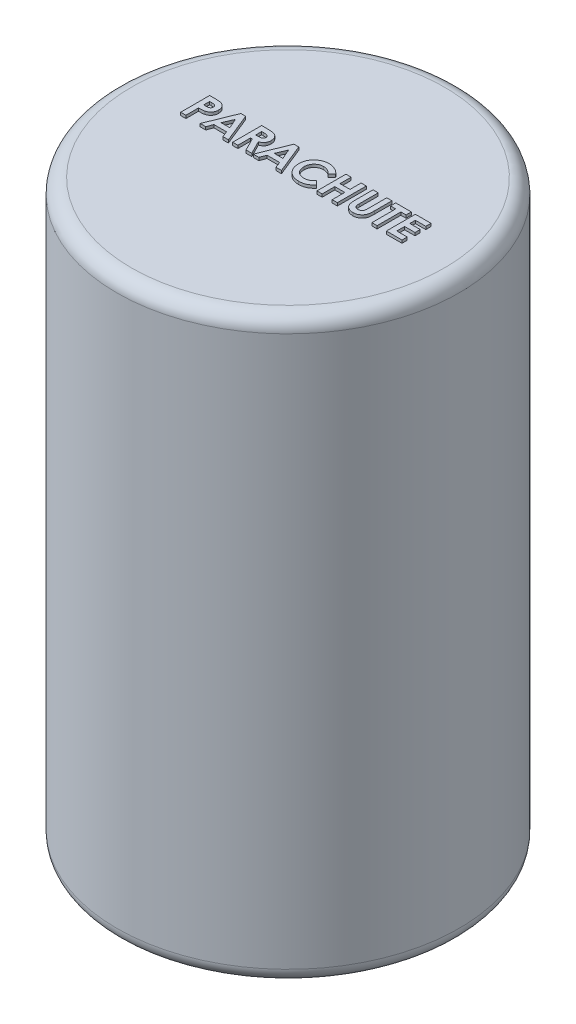
from build123d import *

# Parameters (mm, degrees)
SKETCH1_R           = 75
BOSS_EXTRUDE1_DEPTH = 254
FILLET1_R           = 6.35
BOSS_EXTRUDE2_DEPTH = 1.27
CUT_EXTRUDE1_DEPTH  = 0.635


with BuildPart() as part:
    # Sketch1 → Boss-Extrude1 (new body)
    with BuildSketch(Plane(origin=(0, 0, 0), x_dir=(1, 0, 0), z_dir=(0, 1, 0))):
        with Locations(Location((0, 0, 0), (0, 0, 270))):
            Circle(SKETCH1_R)
    extrude(amount=BOSS_EXTRUDE1_DEPTH)

    # Fillet1
    fillet1_edges = [part.edges().sort_by_distance(p)[0] for p in [
        (0, 0, -75),
        (0, 254, -75),
    ]]
    fillet(fillet1_edges, radius=FILLET1_R)

    # Sketch2 → Boss-Extrude2 (add)
    # profile 1 of 9: a face of its own
    with BuildSketch(Plane(origin=(0, 254, 0), x_dir=(1, 0, 0), z_dir=(0, 1, 0))):
        Polygon((43.147435897, 12.7), (49.985897436, 12.7), (49.985897436, 10.420512821), (45.426923077, 10.420512821), (45.426923077, 7.978205128), (49.985897436, 7.978205128), (49.985897436, 5.698717949), (45.426923077, 5.698717949), (45.426923077, 2.279487179), (49.985897436, 2.279487179), (49.985897436, 0), (43.147435897, 0), align=None)
    # profile 2 of 9: a face of its own
    with BuildSketch(Plane(origin=(0, 254, 0), x_dir=(1, 0, 0), z_dir=(0, 1, 0))):
        Polygon((34.517948718, 12.7), (41.356410256, 12.7), (41.356410256, 10.420512821), (39.076923077, 10.420512821), (39.076923077, 0), (36.797435897, 0), (36.797435897, 10.420512821), (34.517948718, 10.420512821), align=None)
    # profile 3 of 9: a face of its own
    with BuildSketch(Plane(origin=(0, 254, 0), x_dir=(1, 0, 0), z_dir=(0, 1, 0))):
        with BuildLine():
            Line((24.585897436, 12.7), (26.865384615, 12.7))
            Line((26.865384615, 12.7), (26.865384615, 4.436858974))
            add(Edge.make_bspline(
                [(26.865384615, 4.436858974), (26.865508563, 4.351190312), (26.865747966, 4.185722176), (26.877732598, 3.948329576), (26.888699363, 3.730116072), (26.908486521, 3.531320561), (26.937718934, 3.351858005), (26.966025449, 3.190575601), (27.004335517, 3.050360927), (27.061909426, 2.89075992), (27.150611919, 2.711439471), (27.295546871, 2.524547585), (27.462789406, 2.353981612), (27.663239218, 2.21200896), (27.888527079, 2.09716588), (28.137415133, 2.012079867), (28.409552536, 1.964783342), (28.597720623, 1.957562661), (28.694571314, 1.953846154)],
                knots=[0, 0, 0, 0, 1.155499968, 2.231836252, 3.205919964, 4.102923608, 4.924856345, 5.658536265, 6.31071849, 6.882491295, 7.94666036, 8.992281882, 10.060072772, 11.158554251, 12.289267114, 13.461410017, 14.693379945, 16, 16, 16, 16], degree=3))
            add(Edge.make_bspline(
                [(28.694571314, 1.953846154), (28.797463222, 1.956848614), (28.998085022, 1.962702903), (29.286647543, 2.02016909), (29.554002356, 2.111674939), (29.794488646, 2.242277107), (30.007867092, 2.398826694), (30.188487475, 2.577342281), (30.331032418, 2.778179918), (30.423937909, 2.963467931), (30.476099766, 3.134009413), (30.515197677, 3.286381755), (30.543860771, 3.466166036), (30.569864872, 3.670554536), (30.585491333, 3.901664328), (30.602435683, 4.157636795), (30.608645945, 4.440223371), (30.609704438, 4.636993707), (30.61025641, 4.739603365)],
                knots=[0, 0, 0, 0, 1.261321664, 2.459363699, 3.594844139, 4.716940403, 5.803436589, 6.833651888, 7.818396249, 8.814403945, 9.360733334, 10.004355033, 10.743453831, 11.592799886, 12.532235708, 13.585170094, 14.740740724, 16, 16, 16, 16], degree=3))
            Line((30.61025641, 4.739603365), (30.61025641, 12.7))
            Line((30.61025641, 12.7), (32.88974359, 12.7))
            Line((32.88974359, 12.7), (32.88974359, 5.123758013))
            add(Edge.make_bspline(
                [(32.88974359, 5.123758013), (32.889427042, 4.970263712), (32.88881835, 4.675109142), (32.879470686, 4.250951254), (32.859571199, 3.863551061), (32.842857926, 3.512795366), (32.810512019, 3.199156695), (32.776815171, 2.921295721), (32.73386564, 2.680197121), (32.66995932, 2.405735665), (32.559675931, 2.089703349), (32.38188465, 1.725805837), (32.156190125, 1.369528131), (31.889430477, 1.02478953), (31.588234432, 0.704538481), (31.259280153, 0.423399512), (30.907793904, 0.18558626), (30.530102907, -0.003086454), (30.126528596, -0.150236947), (29.693077904, -0.249114667), (29.23004641, -0.315917695), (28.910221806, -0.322334948), (28.745452724, -0.325641026)],
                knots=[0, 0, 0, 0, 1.170808336, 2.251350247, 3.235597562, 4.129743112, 4.929140599, 5.639994148, 6.264258765, 6.79612947, 7.788252245, 8.809469599, 9.879094798, 10.999557536, 12.129761673, 13.226370002, 14.293821979, 15.358369427, 16.438775801, 17.562147481, 18.744053101, 20, 20, 20, 20], degree=3))
            add(Edge.make_bspline(
                [(28.745452724, -0.325641026), (28.635976869, -0.323797049), (28.419983251, -0.320158922), (28.102326745, -0.288080143), (27.795249332, -0.240808085), (27.499328009, -0.171843021), (27.213535687, -0.082753038), (26.937948295, 0.026910526), (26.673589983, 0.156535982), (26.421940062, 0.304931056), (26.18330821, 0.465394783), (25.965211014, 0.64327558), (25.76014324, 0.825418489), (25.574029209, 1.019488857), (25.405471039, 1.223449277), (25.254815876, 1.43776199), (25.122287543, 1.662407959), (25.004552363, 1.901436415), (24.90378254, 2.166996311), (24.818829793, 2.468533723), (24.744613075, 2.810774948), (24.689459589, 3.194491037), (24.639457115, 3.618417305), (24.607808306, 4.083658145), (24.591251389, 4.590226904), (24.587727182, 4.941420524), (24.585897436, 5.123758013)],
                knots=[0, 0, 0, 0, 1.001158378, 1.975264943, 2.917723546, 3.841610987, 4.75185031, 5.653588123, 6.552117133, 7.442167995, 8.324307438, 9.179605724, 10.014504199, 10.831958861, 11.636465792, 12.43274043, 13.225645099, 14.020104002, 14.867201867, 15.819789774, 16.883317127, 18.068162734, 19.364263498, 20.787406516, 22.332041935, 24, 24, 24, 24], degree=3))
            Line((24.585897436, 5.123758013), (24.585897436, 12.7))
        make_face()
    # profile 4 of 9: a face of its own
    with BuildSketch(Plane(origin=(0, 254, 0), x_dir=(1, 0, 0), z_dir=(0, 1, 0))):
        Polygon((12.7, 12.7), (14.979487179, 12.7), (14.979487179, 7.815384615), (19.375641026, 7.815384615), (19.375641026, 12.7), (21.655128205, 12.7), (21.655128205, 0), (19.375641026, 0), (19.375641026, 5.535897436), (14.979487179, 5.535897436), (14.979487179, 0), (12.7, 0), align=None)
    # profile 5 of 9: a face of its own
    with BuildSketch(Plane(origin=(0, 254, 0), x_dir=(1, 0, 0), z_dir=(0, 1, 0))):
        with BuildLine():
            Line((10.420512821, 10.496834936), (8.749058494, 8.899158654))
            add(Edge.make_bspline(
                [(8.749058494, 8.899158654), (8.607272121, 9.045766001), (8.330318914, 9.332136081), (7.884043073, 9.71126483), (7.419932448, 10.027217344), (6.947015383, 10.29331054), (6.456785474, 10.494629007), (5.954911111, 10.641333165), (5.438187679, 10.730773146), (5.088489135, 10.741006662), (4.91260016, 10.746153846)],
                knots=[0, 0, 0, 0, 1.115251505, 2.178435587, 3.19620269, 4.182487026, 5.141301733, 6.088180966, 7.038406374, 8, 8, 8, 8], degree=3))
            add(Edge.make_bspline(
                [(4.91260016, 10.746153846), (4.765711491, 10.742087391), (4.475842887, 10.734062689), (4.050239816, 10.675233713), (3.643128483, 10.575192477), (3.253115281, 10.437317123), (2.881347841, 10.258913733), (2.527046707, 10.040120387), (2.191085392, 9.782913099), (1.877901753, 9.488622671), (1.591412365, 9.167088264), (1.33828075, 8.824011819), (1.126242417, 8.460179305), (0.952226006, 8.079275349), (0.816673949, 7.679536941), (0.71987275, 7.261233199), (0.663885523, 6.823865956), (0.655529055, 6.526546964), (0.651282051, 6.375440705)],
                knots=[0, 0, 0, 0, 1.035432265, 2.043311493, 3.022114605, 3.98653278, 4.95457646, 5.923598177, 6.917315552, 7.932509744, 8.948865224, 9.949768934, 10.933144597, 11.912367597, 12.897413939, 13.903909035, 14.934704909, 16, 16, 16, 16], degree=3))
            add(Edge.make_bspline(
                [(0.651282051, 6.375440705), (0.652505989, 6.26938376), (0.654918396, 6.060343343), (0.681326454, 5.751114549), (0.723849655, 5.451089514), (0.785391262, 5.160722695), (0.862349646, 4.879762458), (0.952639354, 4.605784974), (1.065906465, 4.342575994), (1.191634667, 4.087078518), (1.337855117, 3.846264113), (1.495507736, 3.616627591), (1.666456262, 3.39929461), (1.851807938, 3.195153631), (2.054171359, 3.007394922), (2.26831618, 2.830372355), (2.497854726, 2.668517404), (2.738018901, 2.517768141), (2.990883419, 2.386810973), (3.24958748, 2.26818908), (3.518053559, 2.171850466), (3.79301292, 2.094192754), (4.073482956, 2.028156468), (4.362206923, 1.987495897), (4.656681946, 1.956704123), (4.855697635, 1.954802911), (4.955849359, 1.953846154)],
                knots=[0, 0, 0, 0, 1.103660481, 2.175337485, 3.227646561, 4.255952547, 5.262355991, 6.258840057, 7.255597736, 8.242457506, 9.22035537, 10.185017736, 11.140346927, 12.096287581, 13.051739095, 14.01125915, 14.986044842, 15.97314143, 16.960198552, 17.947847494, 18.933482797, 19.925264591, 20.920966487, 21.929612487, 22.958107872, 24, 24, 24, 24], degree=3))
            add(Edge.make_bspline(
                [(4.955849359, 1.953846154), (5.125723895, 1.958759827), (5.459483183, 1.968413917), (5.94932293, 2.043907532), (6.416091408, 2.168090257), (6.789037189, 2.314742839), (7.081230357, 2.459564168), (7.303672696, 2.593516765), (7.533695412, 2.743357453), (7.767478025, 2.91474138), (8.007650123, 3.105611871), (8.249972117, 3.320149346), (8.500647493, 3.551289394), (8.664862447, 3.716258587), (8.749058494, 3.800841346)],
                knots=[0, 0, 0, 0, 1.404581149, 2.759636711, 4.088442092, 5.392261763, 6.066678138, 6.783632037, 7.538459478, 8.336747902, 9.180226004, 10.074962426, 11.012997595, 12, 12, 12, 12], degree=3))
            Line((8.749058494, 3.800841346), (10.36963141, 2.098858173))
            add(Edge.make_bspline(
                [(10.36963141, 2.098858173), (10.255713857, 1.988874352), (10.033371155, 1.774209454), (9.697973362, 1.469405329), (9.36299768, 1.19550494), (9.036536425, 0.942566902), (8.713241819, 0.717959914), (8.393148149, 0.521459659), (8.079879013, 0.348096362), (7.766929279, 0.200793709), (7.452351612, 0.075718457), (7.12868816, -0.031963125), (6.794949454, -0.12305787), (6.449097171, -0.196559365), (6.094357209, -0.255497641), (5.727409673, -0.295280637), (5.350581193, -0.322025422), (5.094972597, -0.324428662), (4.966025641, -0.325641026)],
                knots=[0, 0, 0, 0, 1.244526981, 2.429050516, 3.560637417, 4.644440555, 5.67424972, 6.652764056, 7.595344123, 8.486817594, 9.369275933, 10.254498637, 11.166417451, 12.086725134, 13.032340136, 13.991389299, 14.986715468, 16, 16, 16, 16], degree=3))
            add(Edge.make_bspline(
                [(4.966025641, -0.325641026), (4.729166055, -0.319603002), (4.265697683, -0.307788269), (3.58649687, -0.220249097), (2.941274328, -0.073491216), (2.328460354, 0.134064907), (1.748249808, 0.399208127), (1.200791125, 0.724261264), (0.686966687, 1.108360704), (0.210927183, 1.547004428), (-0.219673203, 2.031449597), (-0.600274079, 2.551610806), (-0.915107137, 3.110044456), (-1.17651981, 3.698500699), (-1.380941081, 4.319664889), (-1.524819002, 4.974208936), (-1.613547465, 5.661500838), (-1.623254485, 6.13093705), (-1.628205128, 6.370352564)],
                knots=[0, 0, 0, 0, 1.078019885, 2.10938526, 3.111377082, 4.085535484, 5.04941344, 6.010039228, 6.978205633, 7.964457913, 8.951525778, 9.924444315, 10.892603023, 11.863865945, 12.85144698, 13.863884204, 14.910567087, 16, 16, 16, 16], degree=3))
            add(Edge.make_bspline(
                [(-1.628205128, 6.370352564), (-1.626113226, 6.526497319), (-1.621967588, 6.835938061), (-1.578396547, 7.291769345), (-1.517655981, 7.73612331), (-1.421296597, 8.164386091), (-1.305144863, 8.582327176), (-1.160694922, 8.985404036), (-0.988177479, 9.374775152), (-0.793153179, 9.751092356), (-0.572524139, 10.111890367), (-0.326057281, 10.454069362), (-0.060097623, 10.780270898), (0.231745413, 11.086167307), (0.545230965, 11.37444442), (0.881774384, 11.643540007), (1.239351529, 11.897313202), (1.618930229, 12.129219811), (2.013136282, 12.338991665), (2.416997711, 12.5240194), (2.829522276, 12.678659977), (3.248965785, 12.806928632), (3.677100383, 12.902672113), (4.110870153, 12.975146839), (4.553965955, 13.015660675), (4.851466399, 13.022293048), (5.001642628, 13.025641026)],
                knots=[0, 0, 0, 0, 1.071919942, 2.124283339, 3.142214191, 4.149696895, 5.136002878, 6.119640489, 7.086990633, 8.058538607, 9.028339693, 9.988281803, 10.952401235, 11.916291999, 12.888973767, 13.874849856, 14.873389453, 15.898127285, 16.927174885, 17.938320013, 18.946391617, 19.950418109, 20.947802303, 21.956882652, 22.968648068, 24, 24, 24, 24], degree=3))
            add(Edge.make_bspline(
                [(5.001642628, 13.025641026), (5.129758349, 13.023721881), (5.384657745, 13.019903546), (5.764245719, 12.988073571), (6.140797926, 12.938084917), (6.512966194, 12.862662682), (6.88341265, 12.773126959), (7.247269214, 12.655892281), (7.610275918, 12.525212138), (7.966739542, 12.369010711), (8.317157657, 12.198502744), (8.653321167, 12.005055263), (8.980874226, 11.80057281), (9.292558455, 11.572953218), (9.59421237, 11.330452672), (9.884258597, 11.071939772), (10.160151811, 10.793104348), (10.333287073, 10.596090662), (10.420512821, 10.496834936)],
                knots=[0, 0, 0, 0, 0.996412454, 1.982464992, 2.961075852, 3.949442424, 4.934965278, 5.923860011, 6.921385422, 7.934793307, 8.949617135, 9.951082467, 10.950285876, 11.951772932, 12.951063433, 13.960125323, 14.972308753, 16, 16, 16, 16], degree=3))
        make_face()
    # profile 6 of 9: a face of its own
    with BuildSketch(Plane(origin=(0, 254, 0), x_dir=(1, 0, 0), z_dir=(0, 1, 0))):
        Polygon((-10.092327724, 12.7), (-7.978205128, 12.7), (-2.849358974, 0), (-5.284034455, 0), (-6.271133814, 2.605128205), (-11.804487179, 2.605128205), (-12.791586538, 0), (-15.223717949, 0), align=None)
        Polygon((-9.036538462, 9.293489583), (-10.939503205, 4.884615385), (-7.133573718, 4.884615385), align=None, mode=Mode.SUBTRACT)
    # profile 7 of 9: a face of its own
    with BuildSketch(Plane(origin=(0, 254, 0), x_dir=(1, 0, 0), z_dir=(0, 1, 0))):
        with BuildLine():
            Line((-24.26025641, 12.7), (-21.604246795, 12.7))
            add(Edge.make_bspline(
                [(-21.604246795, 12.7), (-21.428685368, 12.699376858), (-21.09103129, 12.69817838), (-20.604152553, 12.679269568), (-20.156887476, 12.652956405), (-19.748573843, 12.612801821), (-19.379386338, 12.559561695), (-19.048954947, 12.496800397), (-18.75728933, 12.425270442), (-18.501929689, 12.336138475), (-18.27148024, 12.235598967), (-18.056669316, 12.120077229), (-17.852757866, 11.990859631), (-17.66110882, 11.84454611), (-17.480056703, 11.68376881), (-17.309259947, 11.508365891), (-17.15113207, 11.31685001), (-17.006652206, 11.110431304), (-16.87497044, 10.893283559), (-16.758591377, 10.665108629), (-16.66395173, 10.425747835), (-16.580327457, 10.178660456), (-16.520095602, 9.920314331), (-16.478205228, 9.653224502), (-16.447534734, 9.376450785), (-16.445771328, 9.188423011), (-16.444871795, 9.092508013)],
                knots=[0, 0, 0, 0, 1.749336639, 3.364467119, 4.854658419, 6.213483162, 7.451590619, 8.570285859, 9.5643256, 10.440900261, 11.26203566, 12.067320669, 12.869050712, 13.665104639, 14.467235401, 15.27997916, 16.102287765, 16.939272006, 17.78853747, 18.631303466, 19.488103222, 20.351255419, 21.228522269, 22.127379805, 23.044756219, 24, 24, 24, 24], degree=3))
            add(Edge.make_bspline(
                [(-16.444871795, 9.092508013), (-16.447208458, 8.992394789), (-16.451790227, 8.796091003), (-16.476470132, 8.507736752), (-16.521577245, 8.231859574), (-16.58989853, 7.969267204), (-16.668424973, 7.716691374), (-16.772844999, 7.478792264), (-16.890693319, 7.252109978), (-17.030658325, 7.039851023), (-17.184263081, 6.837300702), (-17.362902182, 6.652219471), (-17.555002557, 6.474659913), (-17.771362868, 6.315743758), (-18.002445752, 6.164725668), (-18.252842582, 6.027863061), (-18.520919183, 5.901715526), (-18.709390309, 5.831366946), (-18.805769231, 5.795392628)],
                knots=[0, 0, 0, 0, 1.099860209, 2.156625411, 3.176576793, 4.16617041, 5.135385252, 6.078461593, 7.016046972, 7.938469504, 8.868247731, 9.803980173, 10.76021508, 11.73834243, 12.748633912, 13.790971185, 14.870363756, 16, 16, 16, 16], degree=3))
            Line((-18.805769231, 5.795392628), (-15.875, 0))
            Line((-15.875, 0), (-18.408894231, 0))
            Line((-18.408894231, 0), (-21.207371795, 5.535897436))
            Line((-21.207371795, 5.535897436), (-21.980769231, 5.535897436))
            Line((-21.980769231, 5.535897436), (-21.980769231, 0))
            Line((-21.980769231, 0), (-24.26025641, 0))
            Line((-24.26025641, 0), (-24.26025641, 12.7))
        make_face()
        with BuildLine():
            Line((-21.980769231, 7.815384615), (-21.092888622, 7.815384615))
            add(Edge.make_bspline(
                [(-21.092888622, 7.815384615), (-20.984337837, 7.816607187), (-20.776486408, 7.81894815), (-20.477568755, 7.829806504), (-20.206080237, 7.855969773), (-19.960854992, 7.889026085), (-19.740659069, 7.92719437), (-19.547456537, 7.981891842), (-19.378270441, 8.040501566), (-19.235105642, 8.113338251), (-19.112788927, 8.196169359), (-19.007176272, 8.290267557), (-18.919819464, 8.399174239), (-18.847920355, 8.519929791), (-18.791990665, 8.653602268), (-18.751166276, 8.798724247), (-18.72835148, 8.956948855), (-18.72572656, 9.066145378), (-18.724358974, 9.123036859)],
                knots=[0, 0, 0, 0, 1.688639943, 3.233382647, 4.650958383, 5.928841754, 7.082724185, 8.122798841, 9.049171256, 9.863274652, 10.613301712, 11.341792392, 12.054588806, 12.776240173, 13.521029143, 14.301969904, 15.115324896, 16, 16, 16, 16], degree=3))
            add(Edge.make_bspline(
                [(-18.724358974, 9.123036859), (-18.72694452, 9.190343634), (-18.732023346, 9.32255532), (-18.782421073, 9.512893789), (-18.862643369, 9.689065065), (-18.972606164, 9.850273162), (-19.111090008, 9.991599308), (-19.270011145, 10.116179432), (-19.452799477, 10.214688072), (-19.622047717, 10.279663322), (-19.776024056, 10.318538684), (-19.914982843, 10.34750826), (-20.075897956, 10.368039831), (-20.258890876, 10.389817216), (-20.463495148, 10.403938747), (-20.690825987, 10.414244651), (-20.940230502, 10.418461302), (-21.114089136, 10.419809291), (-21.204827724, 10.420512821)],
                knots=[0, 0, 0, 0, 1.020303359, 2.004196876, 2.966617323, 3.9489082, 4.950758222, 5.960522915, 7.003732012, 8.091992268, 8.70421221, 9.413913587, 10.24622431, 11.166358409, 12.212345909, 13.359657661, 14.621978493, 16, 16, 16, 16], degree=3))
            Line((-21.204827724, 10.420512821), (-21.980769231, 10.420512821))
            Line((-21.980769231, 10.420512821), (-21.980769231, 7.815384615))
        make_face(mode=Mode.SUBTRACT)
    # profile 8 of 9: a face of its own
    with BuildSketch(Plane(origin=(0, 254, 0), x_dir=(1, 0, 0), z_dir=(0, 1, 0))):
        Polygon((-33.375661058, 12.7), (-31.261538462, 12.7), (-26.132692308, 0), (-28.567367788, 0), (-29.554467147, 2.605128205), (-35.087820513, 2.605128205), (-36.074919872, 0), (-38.507051282, 0), align=None)
        Polygon((-32.319871795, 9.293489583), (-34.222836538, 4.884615385), (-30.416907051, 4.884615385), align=None, mode=Mode.SUBTRACT)
    # profile 9 of 9: a face of its own
    with BuildSketch(Plane(origin=(0, 254, 0), x_dir=(1, 0, 0), z_dir=(0, 1, 0))):
        with BuildLine():
            Line((-47.055128205, 12.7), (-44.511057692, 12.7))
            add(Edge.make_bspline(
                [(-44.511057692, 12.7), (-44.344831425, 12.699255936), (-44.024146113, 12.69782048), (-43.561691509, 12.68041367), (-43.135054494, 12.649219606), (-42.744333087, 12.610668677), (-42.389687943, 12.556621774), (-42.070674939, 12.494661231), (-41.787227874, 12.419175256), (-41.536150459, 12.329574451), (-41.31081659, 12.223938602), (-41.097578072, 12.111428882), (-40.901254121, 11.9771525), (-40.711935673, 11.835581193), (-40.54044639, 11.673190709), (-40.376087745, 11.500788371), (-40.225820774, 11.311536844), (-40.088949195, 11.107726965), (-39.964785584, 10.893124271), (-39.856307946, 10.667345115), (-39.768316961, 10.430032226), (-39.694503466, 10.182720748), (-39.635215748, 9.925421459), (-39.595751955, 9.656551947), (-39.568946162, 9.377989559), (-39.566580921, 9.188399822), (-39.565384615, 9.092508013)],
                knots=[0, 0, 0, 0, 1.698747864, 3.27724071, 4.728299578, 6.070144658, 7.288476769, 8.393259625, 9.389771311, 10.283485332, 11.113357557, 11.931608583, 12.74405601, 13.541433047, 14.344816069, 15.154114104, 15.974336324, 16.810834471, 17.661136416, 18.50621059, 19.367396281, 20.244825668, 21.142564693, 22.063065223, 23.020325768, 24, 24, 24, 24], degree=3))
            add(Edge.make_bspline(
                [(-39.565384615, 9.092508013), (-39.56711552, 8.986425188), (-39.570516959, 8.7779594), (-39.60386203, 8.472374131), (-39.660825945, 8.181026245), (-39.735274803, 7.901458752), (-39.839088441, 7.638271157), (-39.957690647, 7.385183724), (-40.10360898, 7.149292247), (-40.270344003, 6.927646008), (-40.45243767, 6.718442919), (-40.654212876, 6.527723323), (-40.871823701, 6.354187091), (-41.104010471, 6.19601555), (-41.351644887, 6.053527767), (-41.614548268, 5.925389496), (-41.894515867, 5.815698996), (-42.08947688, 5.758331752), (-42.188321314, 5.729246795)],
                knots=[0, 0, 0, 0, 1.102006807, 2.165578795, 3.188629044, 4.184801286, 5.166646146, 6.124351954, 7.085497154, 8.042432466, 9.003981491, 9.963833307, 10.922997304, 11.89326795, 12.880200226, 13.889073926, 14.929769137, 16, 16, 16, 16], degree=3))
            add(Edge.make_bspline(
                [(-42.188321314, 5.729246795), (-42.253425944, 5.713048658), (-42.394463538, 5.677958276), (-42.627842018, 5.642332731), (-42.896786212, 5.609577233), (-43.202165794, 5.581427848), (-43.544156821, 5.562292825), (-43.922428157, 5.547349224), (-44.337151229, 5.536483682), (-44.625533253, 5.536098125), (-44.775641026, 5.535897436)],
                knots=[0, 0, 0, 0, 0.618981996, 1.340914327, 2.176866532, 3.120127938, 4.170906482, 5.338178032, 6.614476169, 8, 8, 8, 8], degree=3))
            Line((-44.775641026, 5.535897436), (-44.775641026, 0))
            Line((-44.775641026, 0), (-47.055128205, 0))
            Line((-47.055128205, 0), (-47.055128205, 12.7))
        make_face()
        with BuildLine():
            Line((-44.775641026, 7.815384615), (-43.969170673, 7.815384615))
            add(Edge.make_bspline(
                [(-43.969170673, 7.815384615), (-43.82242066, 7.816315124), (-43.552398456, 7.818027275), (-43.183643479, 7.842785964), (-42.887304886, 7.880597484), (-42.653191895, 7.934827948), (-42.468337514, 8.017129857), (-42.308912183, 8.112337668), (-42.172169007, 8.232725332), (-42.053769543, 8.370288836), (-41.95911274, 8.528356198), (-41.893473178, 8.704353596), (-41.850835008, 8.894583137), (-41.846896977, 9.026970307), (-41.844871795, 9.095052083)],
                knots=[0, 0, 0, 0, 1.8619151, 3.425951444, 4.686033666, 5.651700536, 6.461346321, 7.243864085, 7.999046032, 8.762387399, 9.539336099, 10.322741239, 11.137448474, 12, 12, 12, 12], degree=3))
            add(Edge.make_bspline(
                [(-41.844871795, 9.095052083), (-41.846876145, 9.154534244), (-41.850765067, 9.269943939), (-41.879334145, 9.436508753), (-41.924865038, 9.591781521), (-41.990837551, 9.734140624), (-42.07612439, 9.863344171), (-42.180106305, 9.979341264), (-42.301449004, 10.08461608), (-42.395132662, 10.140339648), (-42.442728365, 10.16864984)],
                knots=[0, 0, 0, 0, 1.102301479, 2.1387299, 3.123554645, 4.094223062, 5.036071848, 5.982632524, 6.975082478, 8, 8, 8, 8], degree=3))
            add(Edge.make_bspline(
                [(-42.442728365, 10.16864984), (-42.483044673, 10.189038953), (-42.568402558, 10.232206883), (-42.713775313, 10.282392758), (-42.881533251, 10.324730072), (-43.072808929, 10.359869634), (-43.286839293, 10.387141584), (-43.523586156, 10.407997803), (-43.783397913, 10.416384901), (-43.964081445, 10.419098896), (-44.058213141, 10.420512821)],
                knots=[0, 0, 0, 0, 0.656809284, 1.390599849, 2.23162475, 3.173112763, 4.218524733, 5.370385145, 6.63003504, 8, 8, 8, 8], degree=3))
            Line((-44.058213141, 10.420512821), (-44.775641026, 10.420512821))
            Line((-44.775641026, 10.420512821), (-44.775641026, 7.815384615))
        make_face(mode=Mode.SUBTRACT)
    extrude(amount=BOSS_EXTRUDE2_DEPTH)

    # Sketch3 → Cut-Extrude1 (cut, symmetric)
    # profile 1 of 9: a face of its own
    with BuildSketch(Plane.XY):
        with BuildLine():
            Line((-19.05, 51.19247072), (-19.05, 55.00857649))
            add(Edge.make_bspline(
                [(-19.05, 55.00857649), (-19.048883906, 55.257915892), (-19.046730726, 55.738943863), (-19.020620485, 56.432625748), (-18.973829475, 57.072581339), (-18.916002798, 57.658663224), (-18.834933361, 58.190631676), (-18.741989589, 58.66914881), (-18.628770094, 59.094326995), (-18.494338471, 59.470918743), (-18.335987472, 59.80900191), (-18.166851069, 60.128561709), (-17.966366049, 60.42478855), (-17.748983765, 60.704636994), (-17.510181771, 60.96599013), (-17.250903864, 61.210784633), (-16.967381983, 61.4364998), (-16.661569337, 61.641720541), (-16.33969206, 61.827989658), (-16.001016131, 61.990699744), (-15.645048764, 62.122687962), (-15.274081005, 62.233407725), (-14.888132222, 62.322339435), (-14.484827911, 62.381535087), (-14.066984341, 62.421743787), (-13.782599734, 62.425291647), (-13.638762019, 62.427086105)],
                knots=[0, 0, 0, 0, 1.698787518, 3.27731721, 4.728409951, 6.070286353, 7.288646904, 8.393455548, 9.389990496, 10.283725379, 11.113616976, 11.931887102, 12.744353494, 13.547053751, 14.344590688, 15.153907614, 15.974148981, 16.810666655, 17.660988447, 18.506082349, 19.367288142, 20.244738011, 21.142497992, 22.06302001, 23.020302899, 24, 24, 24, 24], degree=3))
            add(Edge.make_bspline(
                [(-13.638762019, 62.427086105), (-13.479637782, 62.424489748), (-13.166939103, 62.419387587), (-12.708561187, 62.36936999), (-12.271539402, 62.283924087), (-11.852188001, 62.172250907), (-11.457407195, 62.016530062), (-11.077773911, 61.838628165), (-10.723944637, 61.619745413), (-10.391445691, 61.369662447), (-10.077751829, 61.096448687), (-9.791259404, 60.794059039), (-9.532053984, 60.466055197), (-9.288926287, 60.12154631), (-9.081343486, 59.746336696), (-8.887713653, 59.353561137), (-8.723645447, 58.933331537), (-8.637530246, 58.640928299), (-8.593870192, 58.492681057)],
                knots=[0, 0, 0, 0, 1.101964615, 2.165495883, 3.188506962, 4.184641065, 5.166448333, 6.124117473, 7.085225874, 8.042124548, 9.003636759, 9.963451826, 10.9225791, 11.897800977, 12.880319672, 13.889154746, 14.929810112, 16, 16, 16, 16], degree=3))
            add(Edge.make_bspline(
                [(-8.593870192, 58.492681057), (-8.569572986, 58.395024112), (-8.516937414, 58.183467721), (-8.463499097, 57.833400001), (-8.41436585, 57.42998371), (-8.372141772, 56.971914337), (-8.343439238, 56.458927797), (-8.321023836, 55.891520793), (-8.304725523, 55.269436185), (-8.304147187, 54.836863149), (-8.303846154, 54.61170149)],
                knots=[0, 0, 0, 0, 0.618981996, 1.340914327, 2.176866532, 3.120127938, 4.170906482, 5.338178032, 6.614476169, 8, 8, 8, 8], degree=3))
            Line((-8.303846154, 54.61170149), (0, 54.61170149))
            Line((0, 54.61170149), (0, 51.19247072))
            Line((0, 51.19247072), (-19.05, 51.19247072))
        make_face()
        with BuildLine():
            Line((-11.723076923, 54.61170149), (-11.723076923, 55.821407018))
            add(Edge.make_bspline(
                [(-11.723076923, 55.821407018), (-11.724472461, 56.041532299), (-11.727040272, 56.446566087), (-11.76418087, 56.999695578), (-11.820891078, 57.444211671), (-11.90225535, 57.795359605), (-12.025653827, 58.07270428), (-12.16865244, 58.31162543), (-12.349204223, 58.51825644), (-12.558991296, 58.693374544), (-12.795312496, 58.835673507), (-13.057534629, 58.93570067), (-13.341918437, 58.998777758), (-13.540470312, 59.004772476), (-13.642578125, 59.007855336)],
                knots=[0, 0, 0, 0, 1.862197296, 3.426470689, 4.686743892, 5.65255712, 6.462325617, 7.244961981, 8.000258385, 8.771939908, 9.549006364, 10.32248703, 11.137317743, 12, 12, 12, 12], degree=3))
            add(Edge.make_bspline(
                [(-13.642578125, 59.007855336), (-13.731812044, 59.00486982), (-13.904947301, 58.999077202), (-14.154648673, 58.955936582), (-14.386965325, 58.888980141), (-14.598658828, 58.78665021), (-14.794666741, 58.662412349), (-14.968887289, 58.50480117), (-15.126957097, 58.323043087), (-15.210520581, 58.18248208), (-15.25297476, 58.11107048)],
                knots=[0, 0, 0, 0, 1.102449765, 2.139017612, 3.12397484, 4.080535277, 5.035673127, 5.982361139, 6.974944601, 8, 8, 8, 8], degree=3))
            add(Edge.make_bspline(
                [(-15.25297476, 58.11107048), (-15.283558429, 58.050596018), (-15.348310324, 57.92255919), (-15.423589137, 57.704500059), (-15.487095108, 57.452863151), (-15.539804452, 57.165949634), (-15.580712376, 56.844904089), (-15.611996704, 56.489783794), (-15.624577351, 56.100066158), (-15.628648343, 55.829040861), (-15.630769231, 55.687843317)],
                knots=[0, 0, 0, 0, 0.656809284, 1.390599849, 2.23162475, 3.173112763, 4.218524733, 5.370385145, 6.63003504, 8, 8, 8, 8], degree=3))
            Line((-15.630769231, 55.687843317), (-15.630769231, 54.61170149))
            Line((-15.630769231, 54.61170149), (-11.723076923, 54.61170149))
        make_face(mode=Mode.SUBTRACT)
    # profile 2 of 9: a face of its own
    with BuildSketch(Plane.XY):
        Polygon((-19.05, 71.955902211), (-19.05, 75.127086105), (0, 82.820355336), (0, 79.168342115), (-3.907692308, 77.687693076), (-3.907692308, 69.387663028), (0, 67.90701399), (0, 64.258816874), align=None)
        Polygon((-13.940234375, 73.539586105), (-7.326923077, 70.68513899), (-7.326923077, 76.39403322), align=None, mode=Mode.SUBTRACT)
    # profile 3 of 9: a face of its own
    with BuildSketch(Plane.XY):
        with BuildLine():
            Line((-19.05, 85.629009182), (-19.05, 89.613023605))
            add(Edge.make_bspline(
                [(-19.05, 89.613023605), (-19.049079065, 89.876367695), (-19.047307846, 90.38285256), (-19.01876225, 91.113144861), (-18.979904888, 91.784129123), (-18.917691241, 92.396139434), (-18.844345837, 92.950662324), (-18.748738959, 93.445920602), (-18.641790023, 93.883474132), (-18.507986535, 94.266479158), (-18.357297341, 94.612236422), (-18.183641882, 94.934161426), (-17.990765313, 95.241759613), (-17.766180594, 95.525118221), (-17.529926401, 95.800803581), (-17.266069464, 96.055243943), (-16.979193173, 96.292810936), (-16.669354841, 96.509215759), (-16.3431027, 96.708219649), (-15.999256726, 96.879402965), (-15.640613845, 97.025354071), (-15.26894212, 97.147989315), (-14.880534231, 97.23942648), (-14.479819486, 97.302037492), (-14.064680741, 97.348104504), (-13.782636058, 97.350741132), (-13.638762019, 97.352086105)],
                knots=[0, 0, 0, 0, 1.748890285, 3.363608654, 4.853419723, 6.211897754, 7.448506646, 8.566916444, 9.560702549, 10.437053547, 11.257979428, 12.063058964, 12.86458444, 13.665575447, 14.461919362, 15.274455744, 16.096554533, 16.933325211, 17.78237398, 18.632472903, 19.481227396, 20.352186419, 21.229229428, 22.127857616, 23.044999956, 24, 24, 24, 24], degree=3))
            add(Edge.make_bspline(
                [(-13.638762019, 97.352086105), (-13.48859553, 97.348568622), (-13.194146415, 97.34167148), (-12.761567839, 97.304827727), (-12.346703465, 97.236330857), (-11.952215649, 97.135963215), (-11.574064146, 97.015829044), (-11.218150934, 96.860243711), (-10.878179949, 96.68331924), (-10.559753601, 96.473429433), (-10.256028805, 96.242940557), (-9.978036735, 95.975255047), (-9.712599439, 95.685498201), (-9.468755992, 95.364852533), (-9.24802436, 95.014278026), (-9.041438744, 94.640366882), (-8.852668452, 94.237951654), (-8.747082618, 93.955286893), (-8.693088942, 93.810739951)],
                knots=[0, 0, 0, 0, 1.099808295, 2.156523617, 3.176426857, 4.17500812, 5.135317955, 6.078349783, 7.015890908, 7.9382699, 8.868004242, 9.803692517, 10.759882289, 11.743580734, 12.748787378, 13.791075452, 14.870417076, 16, 16, 16, 16], degree=3))
            Line((-8.693088942, 93.810739951), (0, 98.206893797))
            Line((0, 98.206893797), (0, 94.406052451))
            Line((0, 94.406052451), (-8.303846154, 90.208336105))
            Line((-8.303846154, 90.208336105), (-8.303846154, 89.048239951))
            Line((-8.303846154, 89.048239951), (0, 89.048239951))
            Line((0, 89.048239951), (0, 85.629009182))
            Line((0, 85.629009182), (-19.05, 85.629009182))
        make_face()
        with BuildLine():
            Line((-11.723076923, 89.048239951), (-11.723076923, 90.380060865))
            add(Edge.make_bspline(
                [(-11.723076923, 90.380060865), (-11.724910781, 90.542887042), (-11.728422225, 90.854664185), (-11.744709756, 91.303040665), (-11.783954659, 91.710273442), (-11.833539127, 92.078111309), (-11.890791556, 92.408405194), (-11.972837762, 92.698208992), (-12.06075235, 92.951988136), (-12.170007376, 93.166735335), (-12.294254038, 93.350210407), (-12.435401335, 93.508629389), (-12.598761358, 93.639664601), (-12.779894687, 93.747513265), (-12.980403401, 93.8314078), (-13.19808637, 93.892644383), (-13.435423282, 93.926866577), (-13.599218068, 93.930803957), (-13.684555288, 93.932855336)],
                knots=[0, 0, 0, 0, 1.688639943, 3.233382647, 4.650958383, 5.928841754, 7.082724185, 8.122798841, 9.049171256, 9.863274652, 10.613301712, 11.341792392, 12.054588806, 12.776240173, 13.521029143, 14.301969904, 15.115324896, 16, 16, 16, 16], degree=3))
            add(Edge.make_bspline(
                [(-13.684555288, 93.932855336), (-13.785571884, 93.929166659), (-13.982765827, 93.921966014), (-14.267456103, 93.844111119), (-14.532857764, 93.72662856), (-14.775368662, 93.560343187), (-14.987332771, 93.352767222), (-15.174582182, 93.114489138), (-15.320997361, 92.839305903), (-15.423813493, 92.587011672), (-15.481527132, 92.355304815), (-15.524865388, 92.14691145), (-15.557068911, 91.9058027), (-15.583137107, 91.630756802), (-15.60640639, 91.324203253), (-15.621213903, 90.983138787), (-15.627735997, 90.609052657), (-15.629729041, 90.348261675), (-15.630769231, 90.212152211)],
                knots=[0, 0, 0, 0, 1.020140795, 1.991411262, 2.965409065, 3.947543434, 4.949233831, 5.95883764, 7.001880521, 8.094604842, 8.706727239, 9.41631554, 10.248493651, 11.167128553, 12.212949395, 13.360078347, 14.622198054, 16, 16, 16, 16], degree=3))
            Line((-15.630769231, 90.212152211), (-15.630769231, 89.048239951))
            Line((-15.630769231, 89.048239951), (-11.723076923, 89.048239951))
        make_face(mode=Mode.SUBTRACT)
    # profile 4 of 9: a face of its own
    with BuildSketch(Plane.XY):
        Polygon((-19.05, 106.880902211), (-19.05, 110.052086105), (0, 117.745355336), (0, 114.093342115), (-3.907692308, 112.612693076), (-3.907692308, 104.312663028), (0, 102.83201399), (0, 99.183816874), align=None)
        Polygon((-13.940234375, 108.464586105), (-7.326923077, 105.61013899), (-7.326923077, 111.31903322), align=None, mode=Mode.SUBTRACT)
    # profile 5 of 9: a face of its own
    with BuildSketch(Plane.XY):
        with BuildLine():
            Line((-15.745252404, 137.650163028), (-13.348737981, 135.142981538))
            add(Edge.make_bspline(
                [(-13.348737981, 135.142981538), (-13.568687108, 134.930321786), (-13.998316661, 134.514930667), (-14.566479038, 133.845241019), (-15.041955217, 133.150567417), (-15.434364686, 132.437841699), (-15.743224601, 131.705668961), (-15.961622461, 130.95159367), (-16.096255498, 130.176717659), (-16.111542046, 129.652141671), (-16.119230769, 129.388294038)],
                knots=[0, 0, 0, 0, 1.115315123, 2.178559852, 3.196385012, 4.180486591, 5.141138664, 6.08807191, 7.038351522, 8, 8, 8, 8], degree=3))
            add(Edge.make_bspline(
                [(-16.119230769, 129.388294038), (-16.113138454, 129.167957539), (-16.101115941, 128.733147734), (-16.012766672, 128.094793325), (-15.863091593, 127.483942825), (-15.655044322, 126.900111595), (-15.393043045, 126.340413116), (-15.063726331, 125.81005917), (-14.678085521, 125.306199583), (-14.236795442, 124.834721535), (-13.751085956, 124.409078843), (-13.239546799, 124.025568731), (-12.693130082, 123.707909971), (-12.119804235, 123.448605482), (-11.519362227, 123.244267584), (-10.891834114, 123.099240779), (-10.235803049, 123.015212151), (-9.789821832, 123.002684032), (-9.563161058, 122.996316874)],
                knots=[0, 0, 0, 0, 1.035268443, 2.04298821, 3.02163646, 3.985902049, 4.951223231, 5.920091634, 6.913651787, 7.92868536, 8.949353712, 9.945284791, 10.92850487, 11.913014323, 12.897904816, 13.904240668, 14.934873455, 16, 16, 16, 16], degree=3))
            add(Edge.make_bspline(
                [(-9.563161058, 122.996316874), (-9.404080142, 122.998180352), (-9.090528387, 123.001853305), (-8.627876114, 123.040963109), (-8.178077051, 123.106093939), (-7.742212238, 123.196821632), (-7.31971255, 123.313127013), (-6.909588663, 123.447479773), (-6.516730476, 123.619082545), (-6.133782232, 123.80784333), (-5.769962279, 124.025006689), (-5.425031087, 124.26280123), (-5.098911451, 124.519035444), (-4.792762936, 124.797131368), (-4.510992758, 125.100590833), (-4.245928705, 125.422084832), (-4.001751881, 125.764807157), (-3.782350631, 126.128895173), (-3.577845406, 126.503331174), (-3.408495406, 126.895828992), (-3.256257939, 127.29540973), (-3.141730006, 127.709086338), (-3.042114781, 128.12957113), (-2.981276692, 128.562717082), (-2.935047781, 129.004413416), (-2.932201553, 129.302939144), (-2.930769231, 129.453167836)],
                knots=[0, 0, 0, 0, 1.103738238, 2.175490744, 3.219137561, 4.256155604, 5.262629953, 6.259184223, 7.247888397, 8.234817694, 9.220364322, 10.185094651, 11.140491148, 12.096499151, 13.05201798, 14.011605636, 14.986460005, 15.968997565, 16.960259839, 17.944382265, 18.933125845, 19.924977513, 20.920749559, 21.929466621, 22.958034467, 24, 24, 24, 24], degree=3))
            add(Edge.make_bspline(
                [(-2.930769231, 129.453167836), (-2.938111922, 129.707989869), (-2.9525384, 130.208648901), (-3.066175128, 130.943262787), (-3.2511114, 131.644405198), (-3.475810738, 132.202590789), (-3.693688611, 132.640164788), (-3.889551086, 132.976077202), (-4.11534933, 133.31975165), (-4.372020955, 133.67066474), (-4.658444426, 134.030853234), (-4.980216364, 134.394356502), (-5.326936161, 134.770363812), (-5.574388582, 135.016687052), (-5.701262019, 135.142981538)],
                knots=[0, 0, 0, 0, 1.404693586, 2.759857621, 4.088769373, 5.395275838, 6.0697462, 6.783214465, 7.53810233, 8.336454657, 9.18000028, 10.074808326, 11.012918585, 12, 12, 12, 12], degree=3))
            Line((-5.701262019, 135.142981538), (-3.14828726, 137.573840913))
            add(Edge.make_bspline(
                [(-3.14828726, 137.573840913), (-2.983311528, 137.402964583), (-2.66131418, 137.06945053), (-2.204107994, 136.56635384), (-1.79325741, 136.063890318), (-1.413850353, 135.574198434), (-1.076939871, 135.089256526), (-0.782189489, 134.60911602), (-0.522144543, 134.139212317), (-0.301190563, 133.669787716), (-0.113577685, 133.197921215), (0.047944688, 132.712426038), (0.184586805, 132.211817979), (0.294839047, 131.693039553), (0.383246462, 131.16092961), (0.442920956, 130.610508307), (0.483038132, 130.045265587), (0.486642993, 129.661852693), (0.488461538, 129.468432259)],
                knots=[0, 0, 0, 0, 1.244526981, 2.429050516, 3.560637417, 4.644440555, 5.67424972, 6.652764056, 7.595344123, 8.486817594, 9.369275933, 10.254498637, 11.166417451, 12.086725134, 13.032340136, 13.991389299, 14.986715468, 16, 16, 16, 16], degree=3))
            add(Edge.make_bspline(
                [(0.488461538, 129.468432259), (0.479404504, 129.113142879), (0.461682404, 128.417940322), (0.330373645, 127.399139102), (0.110236823, 126.43130529), (-0.201097361, 125.512084329), (-0.59881219, 124.641768509), (-1.086391896, 123.820580485), (-1.662541055, 123.049843827), (-2.320506641, 122.335784572), (-3.047174395, 121.689883993), (-3.827416209, 121.118982679), (-4.665066684, 120.646733092), (-5.547751049, 120.254614083), (-6.479497333, 119.947982175), (-7.461313404, 119.732165295), (-8.492251257, 119.5990726), (-9.196405576, 119.58451207), (-9.555528846, 119.577086105)],
                knots=[0, 0, 0, 0, 1.078019885, 2.10938526, 3.111377082, 4.085535484, 5.04941344, 6.010039228, 6.978205633, 7.964457913, 8.951525778, 9.924444315, 10.892603023, 11.863865945, 12.85144698, 13.863884204, 14.910567087, 16, 16, 16, 16], degree=3))
            add(Edge.make_bspline(
                [(-9.555528846, 119.577086105), (-9.789751602, 119.580193028), (-10.253923859, 119.586350189), (-10.938843362, 119.652275839), (-11.605680758, 119.741820318), (-12.24873768, 119.888915268), (-12.875333807, 120.059919654), (-13.479924128, 120.280233437), (-14.065055403, 120.536194414), (-14.629988621, 120.828454333), (-15.168623252, 121.163194113), (-15.684394349, 121.527636767), (-16.170620646, 121.93062098), (-16.629306794, 122.368068039), (-17.065648203, 122.835935574), (-17.468913789, 123.342236429), (-17.849922214, 123.878335835), (-18.197310319, 124.447947447), (-18.513253825, 125.038091544), (-18.785068439, 125.645900544), (-19.018295336, 126.263538841), (-19.210311899, 126.8928792), (-19.354030098, 127.535034435), (-19.462714369, 128.185701696), (-19.523492519, 128.850342047), (-19.533440078, 129.296593167), (-19.538461538, 129.52185774)],
                knots=[0, 0, 0, 0, 1.071814294, 2.12407397, 3.147667899, 4.14936388, 5.141177959, 6.119239245, 7.091825145, 8.063277363, 9.028022524, 9.992609517, 10.952139039, 11.915934802, 12.892469547, 13.878248468, 14.87668965, 15.901326483, 16.93027266, 17.938917451, 18.9468897, 19.950817235, 20.948103127, 21.957084021, 22.968749718, 24, 24, 24, 24], degree=3))
            add(Edge.make_bspline(
                [(-19.538461538, 129.52185774), (-19.535580128, 129.714030436), (-19.529847265, 130.096377768), (-19.482142084, 130.665772801), (-19.407008861, 131.230551745), (-19.29444097, 131.788989946), (-19.158116072, 132.343598671), (-18.990200599, 132.892055917), (-18.785383078, 133.432849298), (-18.558811675, 133.970667066), (-18.300871898, 134.494783246), (-18.01215886, 135.000642912), (-17.70022557, 135.489499495), (-17.359706727, 135.958406004), (-16.995604111, 136.410665146), (-16.607929772, 136.845794371), (-16.189651398, 137.259618284), (-15.894134275, 137.519323325), (-15.745252404, 137.650163028)],
                knots=[0, 0, 0, 0, 0.996333415, 1.982307736, 2.96084097, 3.949129141, 4.93457382, 5.921430247, 6.92116383, 7.931890485, 8.946633814, 9.948019707, 10.950686436, 11.952094051, 12.951305284, 13.960287133, 14.972390273, 16, 16, 16, 16], degree=3))
        make_face()
    # profile 6 of 9: a face of its own
    with BuildSketch(Plane.XY):
        Polygon((-19.05, 141.069393797), (-19.05, 144.488624567), (-11.723076923, 144.488624567), (-11.723076923, 151.082855336), (-19.05, 151.082855336), (-19.05, 154.502086105), (0, 154.502086105), (0, 151.082855336), (-8.303846154, 151.082855336), (-8.303846154, 144.488624567), (0, 144.488624567), (0, 141.069393797), align=None)
    # profile 7 of 9: a face of its own
    with BuildSketch(Plane.XY):
        with BuildLine():
            Line((-19.05, 158.898239951), (-19.05, 162.31747072))
            Line((-19.05, 162.31747072), (-6.655288462, 162.31747072))
            add(Edge.make_bspline(
                [(-6.655288462, 162.31747072), (-6.526786355, 162.317664202), (-6.278585864, 162.31803791), (-5.922485169, 162.335914285), (-5.593940248, 162.352762543), (-5.295614223, 162.38142932), (-5.026581028, 162.426395181), (-4.785849471, 162.46837714), (-4.575564904, 162.525935183), (-4.336042218, 162.612128616), (-4.066964157, 162.74669604), (-3.783344839, 162.960131865), (-3.5308997, 163.215010389), (-3.318934988, 163.515168807), (-3.139652793, 163.850285251), (-3.021072636, 164.226963922), (-2.940641845, 164.632959546), (-2.934121649, 164.915816999), (-2.930769231, 165.061250768)],
                knots=[0, 0, 0, 0, 1.155195489, 2.231248153, 3.20507519, 4.113220553, 4.92363642, 5.657123012, 6.309133385, 6.880755525, 7.944644177, 8.999147208, 10.058600405, 11.156792429, 12.29246015, 13.460660758, 14.694375292, 16, 16, 16, 16], degree=3))
            add(Edge.make_bspline(
                [(-2.930769231, 165.061250768), (-2.935272921, 165.21558863), (-2.944054355, 165.51652133), (-3.030253634, 165.949365114), (-3.16751241, 166.350397324), (-3.363415658, 166.711126791), (-3.598240051, 167.031194349), (-3.866013386, 167.302125308), (-4.167270004, 167.515941359), (-4.445201507, 167.655303923), (-4.701014919, 167.733536748), (-4.929568737, 167.792222932), (-5.198019168, 167.834836456), (-5.504501681, 167.874731496), (-5.851249328, 167.897349564), (-6.236449538, 167.923108071), (-6.660336679, 167.932345288), (-6.955491117, 167.933944482), (-7.109405048, 167.934778413)],
                knots=[0, 0, 0, 0, 1.26131785, 2.459356261, 3.594833267, 4.716926138, 5.803419038, 6.833631221, 7.818372604, 8.814377287, 9.360705024, 10.004324776, 10.743421339, 11.582437492, 12.532246195, 13.585177397, 14.740744533, 16, 16, 16, 16], degree=3))
            Line((-7.109405048, 167.934778413), (-19.05, 167.934778413))
            Line((-19.05, 167.934778413), (-19.05, 171.354009182))
            Line((-19.05, 171.354009182), (-7.685637019, 171.354009182))
            add(Edge.make_bspline(
                [(-7.685637019, 171.354009182), (-7.455395569, 171.35353436), (-7.012663713, 171.352621322), (-6.376426881, 171.338599826), (-5.795326592, 171.308750596), (-5.269193048, 171.283680687), (-4.798735047, 171.235161822), (-4.381943569, 171.184616563), (-4.020295722, 171.120192231), (-3.608603327, 171.024332889), (-3.134556319, 170.858906839), (-2.588703761, 170.592224064), (-2.054312172, 170.253665819), (-1.537105641, 169.853591353), (-1.05709989, 169.40155288), (-0.634518479, 168.909538045), (-0.282901993, 168.379803864), (0.001396051, 167.814797212), (0.220303823, 167.208555884), (0.375033417, 166.559650046), (0.473492142, 165.864368836), (0.48337172, 165.384694348), (0.488461538, 165.137572884)],
                knots=[0, 0, 0, 0, 1.170930413, 2.251584989, 3.235934929, 4.130173708, 4.929654547, 5.640582214, 6.264911921, 6.796838084, 7.789064304, 8.810388137, 9.880124863, 11.000704429, 12.131026409, 13.227749078, 14.29171941, 15.356377855, 16.43689688, 17.561893293, 18.743922147, 20, 20, 20, 20], degree=3))
            add(Edge.make_bspline(
                [(0.488461538, 165.137572884), (0.485687632, 164.97336149), (0.480214772, 164.649375779), (0.432210457, 164.172856762), (0.360888389, 163.712365208), (0.2588546, 163.26765684), (0.119571362, 162.840265104), (-0.045027465, 162.427423797), (-0.23335977, 162.027637437), (-0.461922537, 161.653399887), (-0.702001433, 161.295517413), (-0.96468484, 160.965996318), (-1.238323921, 160.659770052), (-1.529182087, 160.380395481), (-1.835187395, 160.127611482), (-2.156639385, 159.901614506), (-2.493612982, 159.702826501), (-2.852154013, 159.526219798), (-3.250495968, 159.375077459), (-3.702794252, 159.247594896), (-4.21496033, 159.136771489), (-4.790368248, 159.052877735), (-5.426398085, 158.978935834), (-6.125477083, 158.93102452), (-6.885343221, 158.906293979), (-7.412131764, 158.900992464), (-7.685637019, 158.898239951)],
                knots=[0, 0, 0, 0, 1.001237316, 1.975420686, 2.917953599, 3.841913885, 4.754568974, 5.656377887, 6.55158913, 7.445656762, 8.327865759, 9.178398172, 10.013362476, 10.830881591, 11.635451955, 12.431789376, 13.224756564, 14.019278107, 14.866442763, 15.819105778, 16.882716987, 18.059987251, 19.363897986, 20.787153213, 22.331910422, 24, 24, 24, 24], degree=3))
            Line((-7.685637019, 158.898239951), (-19.05, 158.898239951))
        make_face()
    # profile 8 of 9: a face of its own
    with BuildSketch(Plane.XY):
        Polygon((-19.05, 173.796316874), (-19.05, 184.054009182), (-15.630769231, 184.054009182), (-15.630769231, 180.634778413), (0, 180.634778413), (0, 177.215547643), (-15.630769231, 177.215547643), (-15.630769231, 173.796316874), align=None)
    # profile 9 of 9: a face of its own
    with BuildSketch(Plane.XY):
        Polygon((-19.05, 186.740547643), (-19.05, 196.998239951), (-15.630769231, 196.998239951), (-15.630769231, 190.159778413), (-11.967307692, 190.159778413), (-11.967307692, 196.998239951), (-8.548076923, 196.998239951), (-8.548076923, 190.159778413), (-3.419230769, 190.159778413), (-3.419230769, 196.998239951), (0, 196.998239951), (0, 186.740547643), align=None)
    extrude(amount=CUT_EXTRUDE1_DEPTH, both=True, mode=Mode.SUBTRACT)


solid = part.part
